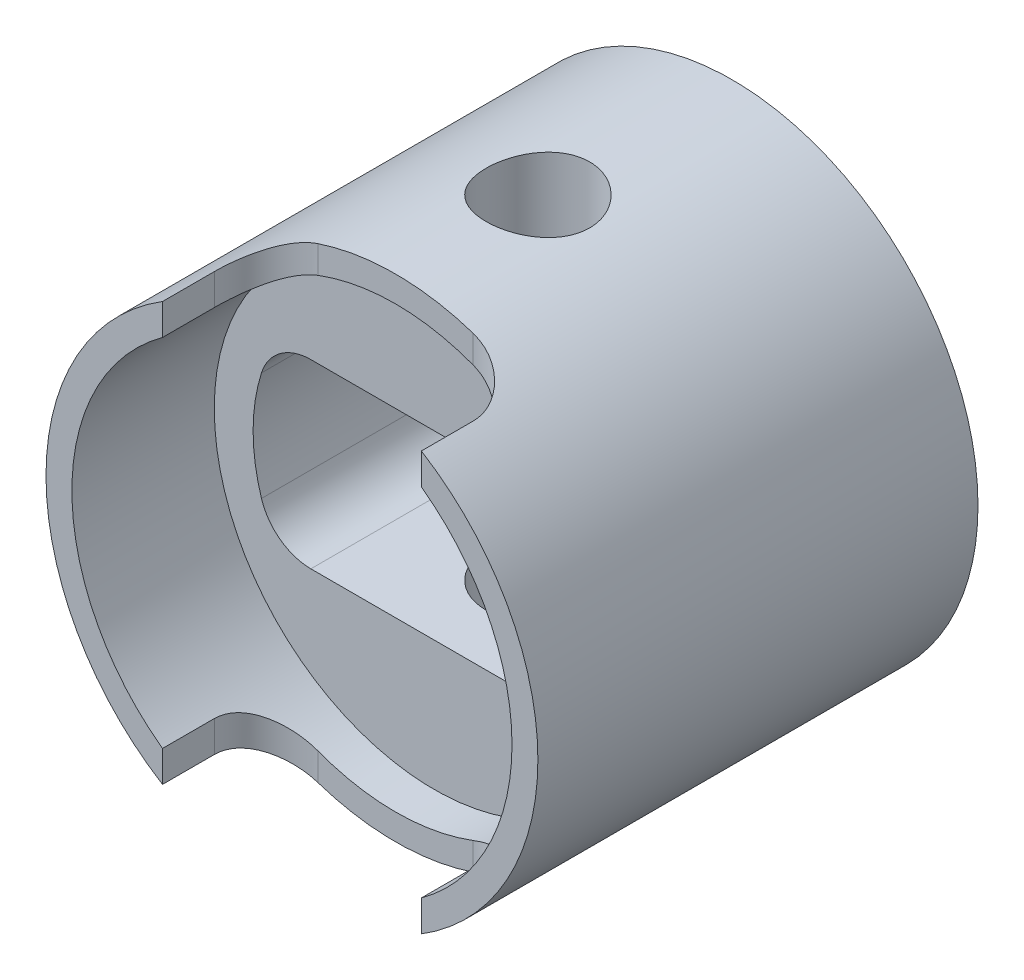
from build123d import *

# Parameters (mm, degrees)
ESQUISSE1_R             = 9.5
BASE_EXTRUSION_DEPTH    = 17
ESQUISSE2_R             = 8.5
ENL_V_MAT_EXTRU_1_DEPTH = 5.5
ESQUISSE3_R             = 2
ENL_V_MAT_EXTRU_2_DEPTH = 15
ENL_V_MAT_EXTRU_3_DEPTH = 10
CONG_1_R                = 1


with BuildPart() as part:
    # Esquisse1 → Base-Extrusion (new body)
    with BuildSketch(Plane.XY):
        Circle(ESQUISSE1_R)
    extrude(amount=BASE_EXTRUSION_DEPTH)

    # Esquisse2 → Enlèv. mat.-Extru.1 (cut)
    with BuildSketch(Plane.XY.offset(17)):
        Circle(ESQUISSE2_R)
    extrude(amount=-ENL_V_MAT_EXTRU_1_DEPTH, mode=Mode.SUBTRACT)

    # Esquisse3 → Enlèv. mat.-Extru.2 (cut, symmetric)
    with BuildSketch(Plane(origin=(0, 0, 0), x_dir=(1, 0, 0), z_dir=(0, 1, 0))):
        with Locations(Location((0, -7.5, 0), (0, 0, 270))):
            Circle(ESQUISSE3_R)
        with BuildLine():
            Line((-5, -17), (5, -17))
            Line((5, -17), (5, -15))
            ThreePointArc((5, -15), (4.414213562, -13.585786438), (3, -13))
            Line((3, -13), (-3, -13))
            ThreePointArc((-3, -13), (-4.414213562, -13.585786438), (-5, -15))
            Line((-5, -15), (-5, -17))
        make_face()
    extrude(amount=ENL_V_MAT_EXTRU_2_DEPTH, both=True, mode=Mode.SUBTRACT)

    # Esquisse4 → Enlèv. mat.-Extru.3 (cut)
    with BuildSketch(Plane.XY.offset(11.5)):
        with BuildLine():
            Line((-4.769696007, 3.5), (4.769696007, 3.5))
            ThreePointArc((4.769696007, 3.5), (5.952911964, 3.11245155), (6.67757441, 2.1))
            ThreePointArc((6.67757441, 2.1), (7, 0), (6.67757441, -2.1))
            ThreePointArc((6.67757441, -2.1), (5.952911964, -3.11245155), (4.769696007, -3.5))
            Line((4.769696007, -3.5), (-4.769696007, -3.5))
            ThreePointArc((-4.769696007, -3.5), (-5.952911964, -3.11245155), (-6.67757441, -2.1))
            ThreePointArc((-6.67757441, -2.1), (-7, 0), (-6.67757441, 2.1))
            ThreePointArc((-6.67757441, 2.1), (-5.952911964, 3.11245155), (-4.769696007, 3.5))
        make_face()
    extrude(amount=-ENL_V_MAT_EXTRU_3_DEPTH, mode=Mode.SUBTRACT)

    # Congé1
    cong_1_edges = [part.edges().sort_by_distance(p)[0] for p in [
        (0, 3.5, 1.5),
        (0, -3.5, 1.5),
        (-5.952911964, 3.11245155, 1.5),
        (5.952911964, 3.11245155, 1.5),
        (7, 0, 1.5),
        (5.952911964, -3.11245155, 1.5),
        (-5.952911964, -3.11245155, 1.5),
        (-7, 0, 1.5),
    ]]
    fillet(cong_1_edges, radius=CONG_1_R)


solid = part.part
